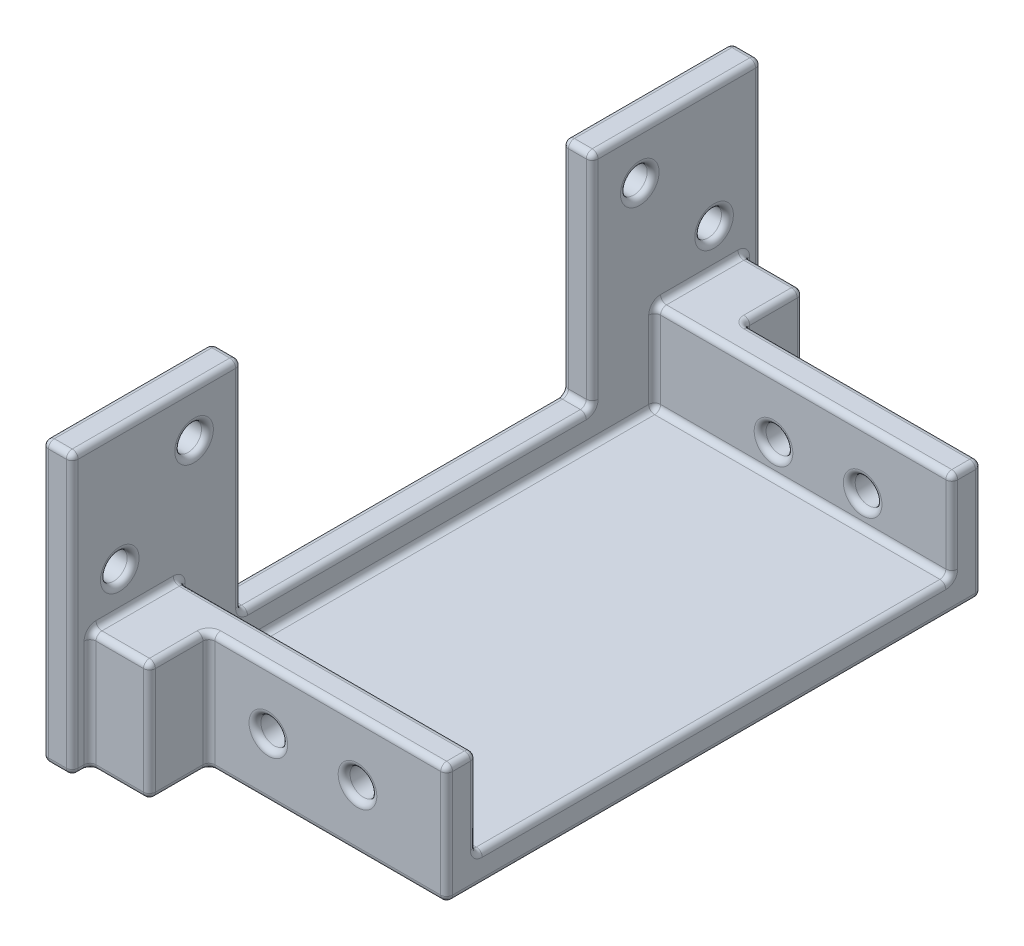
from build123d import *

# Parameters (mm, degrees)
SKETCH1_R           = 2.25
BOSS_EXTRUDE1_DEPTH = 5
BOSS_EXTRUDE2_DEPTH = 50
SKETCH8_W           = 10
SKETCH8_H           = 20
BOSS_EXTRUDE3_DEPTH = 10
SKETCH9_R           = 2.25
CUT_EXTRUDE4_DEPTH  = 110
FILLET5_R           = 1


with BuildPart() as part:
    # Sketch1 → Boss-Extrude1 (new body)
    with BuildSketch(Plane(origin=(0, 0, 0), x_dir=(0, 0, -1), z_dir=(1, 0, 0))):
        Polygon((-38.693472114, 11.344926417), (-10.193472114, 11.344926417), (-10.193472114, -25.655073583), (48.806527886, -25.655073583), (48.806527886, 11.344926417), (77.306527886, 11.344926417), (77.306527886, -35.655073583), (-38.693472114, -35.655073583), align=None)
        with Locations((-30.693472114, -9.155073583)):
            Circle(SKETCH1_R, mode=Mode.SUBTRACT)
        with Locations((-18.193472114, 3.344926417)):
            Circle(SKETCH1_R, mode=Mode.SUBTRACT)
        with Locations((69.306527886, -9.155073583)):
            Circle(SKETCH1_R, mode=Mode.SUBTRACT)
        with Locations((56.806527886, 3.344926417)):
            Circle(SKETCH1_R, mode=Mode.SUBTRACT)
    extrude(amount=BOSS_EXTRUDE1_DEPTH)

    # Sketch2 → Boss-Extrude2 (add)
    with BuildSketch(Plane(origin=(5, 0, 0), x_dir=(0, 0, -1), z_dir=(1, 0, 0))):
        Polygon((-25.693472114, -35.655073583), (64.306527886, -35.655073583), (64.306527886, -15.655073583), (59.306527886, -15.655073583), (59.306527886, -30.655073583), (-20.693472114, -30.655073583), (-20.693472114, -15.655073583), (-25.693472114, -15.655073583), align=None)
    extrude(amount=BOSS_EXTRUDE2_DEPTH)

    # Sketch8 → Boss-Extrude3 (add)
    with BuildSketch(Plane(origin=(5, 0, 0), x_dir=(0, 0, -1), z_dir=(1, 0, 0))):
        with Locations((-30.693472114, -25.655073583)):
            Rectangle(SKETCH8_W, SKETCH8_H)
        with Locations((69.306527886, -25.655073583)):
            Rectangle(SKETCH8_W, SKETCH8_H)
    extrude(amount=BOSS_EXTRUDE3_DEPTH)

    # Sketch9 → Cut-Extrude4 (cut)
    with BuildSketch(Plane.XY.offset(25.693472114)):
        with Locations((25, -25.655073583)):
            Circle(SKETCH9_R)
        with Locations((40, -25.655073583)):
            Circle(SKETCH9_R)
    extrude(amount=-CUT_EXTRUDE4_DEPTH, mode=Mode.SUBTRACT)

    # Fillet5
    fillet5_edges = [part.edges().sort_by_distance(p)[0] for p in [
        (22.75, -25.655073583, -59.306527886),
        (22.75, -25.655073583, -64.306527886),
        (22.75, -25.655073583, 20.693472114),
        (22.75, -25.655073583, 25.693472114),
        (0, 11.344926417, -63.056527886),
        (37.75, -25.655073583, -59.306527886),
        (37.75, -25.655073583, -64.306527886),
        (37.75, -25.655073583, 20.693472114),
        (37.75, -25.655073583, 25.693472114),
        (0, -12.155073583, -77.306527886),
        (0, -35.655073583, -19.306527886),
        (0, -12.155073583, 38.693472114),
        (5, -12.155073583, -77.306527886),
        (2.5, 11.344926417, 38.693472114),
        (2.5, 11.344926417, 10.193472114),
        (2.5, -25.655073583, 10.193472114),
        (2.5, -25.655073583, -48.806527886),
        (2.5, 11.344926417, -48.806527886),
        (2.5, 11.344926417, -77.306527886),
        (2.5, -35.655073583, -77.306527886),
        (2.5, -35.655073583, 38.693472114),
        (5, 11.344926417, -63.056527886),
        (5, -7.155073583, -48.806527886),
        (0, -9.155073583, 32.943472114),
        (5, -9.155073583, 32.943472114),
        (5, -25.655073583, -19.306527886),
        (0, 3.344926417, 20.443472114),
        (5, 3.344926417, 20.443472114),
        (5, -7.155073583, 10.193472114),
        (0, -9.155073583, -67.056527886),
        (5, -9.155073583, -67.056527886),
        (5, 11.344926417, 24.443472114),
        (0, 3.344926417, -54.556527886),
        (5, 3.344926417, -54.556527886),
        (35, -15.655073583, 25.693472114),
        (35, -35.655073583, 25.693472114),
        (35, -35.655073583, -64.306527886),
        (5, -15.655073583, -66.806527886),
        (35, -15.655073583, -64.306527886),
        (5, -23.155073583, -59.306527886),
        (30, -15.655073583, -59.306527886),
        (5, -30.655073583, -19.306527886),
        (30, -30.655073583, -59.306527886),
        (5, -23.155073583, 20.693472114),
        (30, -30.655073583, 20.693472114),
        (5, -15.655073583, 28.193472114),
        (30, -15.655073583, 20.693472114),
        (55, -25.655073583, 25.693472114),
        (55, -35.655073583, -19.306527886),
        (55, -25.655073583, -64.306527886),
        (5, -12.155073583, 38.693472114),
        (55, -15.655073583, -61.806527886),
        (55, -23.155073583, -59.306527886),
        (55, -30.655073583, -19.306527886),
        (55, -23.155073583, 20.693472114),
        (55, -15.655073583, 23.193472114),
        (5, -25.655073583, 35.693472114),
        (10, -15.655073583, 35.693472114),
        (10, -35.655073583, 35.693472114),
        (15, -25.655073583, 25.693472114),
        (15, -15.655073583, 30.693472114),
        (15, -25.655073583, 35.693472114),
        (15, -35.655073583, 30.693472114),
        (5, -35.655073583, -75.806527886),
        (5, -25.655073583, -74.306527886),
        (10, -35.655073583, -74.306527886),
        (10, -15.655073583, -74.306527886),
        (15, -25.655073583, -64.306527886),
        (15, -35.655073583, -69.306527886),
        (15, -25.655073583, -74.306527886),
        (15, -15.655073583, -69.306527886),
        (0, 11.344926417, 24.443472114),
        (5, -35.655073583, 37.193472114),
        (0, -7.155073583, 10.193472114),
        (0, -25.655073583, -19.306527886),
        (0, -7.155073583, -48.806527886),
    ]]
    fillet(fillet5_edges, radius=FILLET5_R)


solid = part.part
